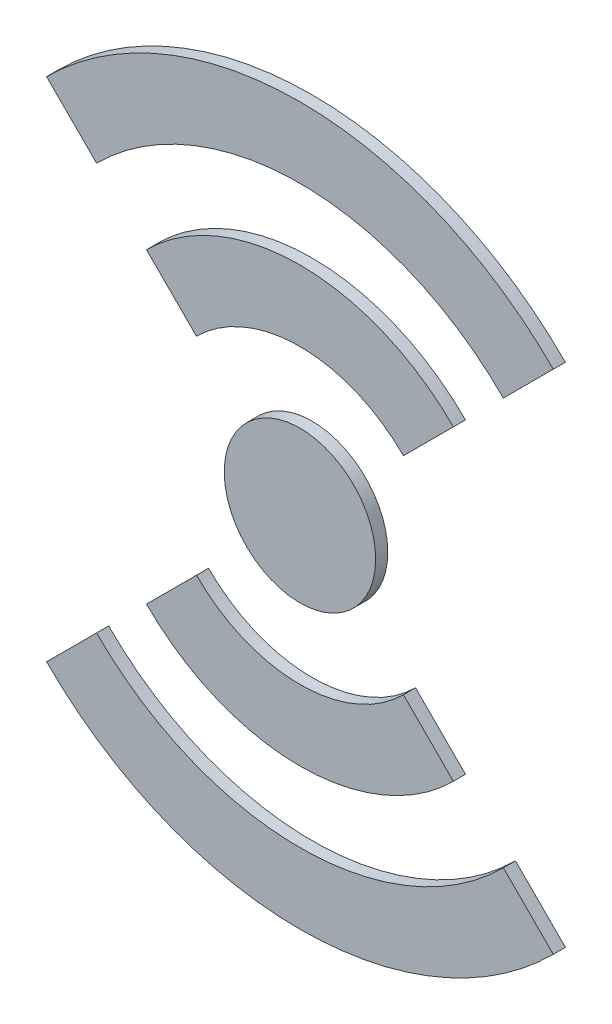
from build123d import *

# Parameters (mm, degrees)
SKICA1_R                  = 7.5
P_IDAT_VYSUNUT_M1_DEPTH   = 1.2
P_IDAT_VYSUNUT_M1_2_DEPTH = 1.2
P_IDAT_VYSUNUT_M1_3_DEPTH = 1.2
P_IDAT_VYSUNUT_M1_4_DEPTH = 1.2
P_IDAT_VYSUNUT_M1_5_DEPTH = 1.2


with BuildPart() as part:
    # Skica1 → Přidat vysunutím1 (new body)
    with BuildSketch(Plane.XY):
        Circle(SKICA1_R)
    extrude(amount=P_IDAT_VYSUNUT_M1_DEPTH)


with BuildPart() as body_2:
    # Skica1 → P_idat vysunut_m1 2 (new body)
    with BuildSketch(Plane.XY):
        with BuildLine():
            ThreePointArc((-10.253048327, 10.253048327), (0, 14.5), (10.253048327, 10.253048327))
            Line((10.253048327, 10.253048327), (15.202795796, 15.202795796))
            ThreePointArc((15.202795796, 15.202795796), (0, 21.5), (-15.202795796, 15.202795796))
            Line((-15.202795796, 15.202795796), (-10.253048327, 10.253048327))
        make_face()
    extrude(amount=P_IDAT_VYSUNUT_M1_2_DEPTH)


with BuildPart() as body_3:
    # Skica1 → P_idat vysunut_m1 3 (new body)
    with BuildSketch(Plane.XY):
        with BuildLine():
            ThreePointArc((10.253048327, -10.253048327), (0, -14.5), (-10.253048327, -10.253048327))
            Line((-10.253048327, -10.253048327), (-15.202795796, -15.202795796))
            ThreePointArc((-15.202795796, -15.202795796), (0, -21.5), (15.202795796, -15.202795796))
            Line((15.202795796, -15.202795796), (10.253048327, -10.253048327))
        make_face()
    extrude(amount=P_IDAT_VYSUNUT_M1_3_DEPTH)


with BuildPart() as body_4:
    # Skica1 → P_idat vysunut_m1 4 (new body)
    with BuildSketch(Plane.XY):
        with BuildLine():
            ThreePointArc((-20.152543264, 20.152543264), (0, 28.5), (20.152543264, 20.152543264))
            Line((20.152543264, 20.152543264), (25.102290732, 25.102290732))
            ThreePointArc((25.102290732, 25.102290732), (0, 35.5), (-25.102290732, 25.102290732))
            Line((-25.102290732, 25.102290732), (-20.152543264, 20.152543264))
        make_face()
    extrude(amount=P_IDAT_VYSUNUT_M1_4_DEPTH)


with BuildPart() as body_5:
    # Skica1 → P_idat vysunut_m1 5 (new body)
    with BuildSketch(Plane.XY):
        with BuildLine():
            ThreePointArc((20.152543264, -20.152543264), (0, -28.5), (-20.152543264, -20.152543264))
            Line((-20.152543264, -20.152543264), (-25.102290732, -25.102290732))
            ThreePointArc((-25.102290732, -25.102290732), (0, -35.5), (25.102290732, -25.102290732))
            Line((25.102290732, -25.102290732), (20.152543264, -20.152543264))
        make_face()
    extrude(amount=P_IDAT_VYSUNUT_M1_5_DEPTH)


solid = Compound([part.part, body_2.part, body_3.part, body_4.part, body_5.part])
